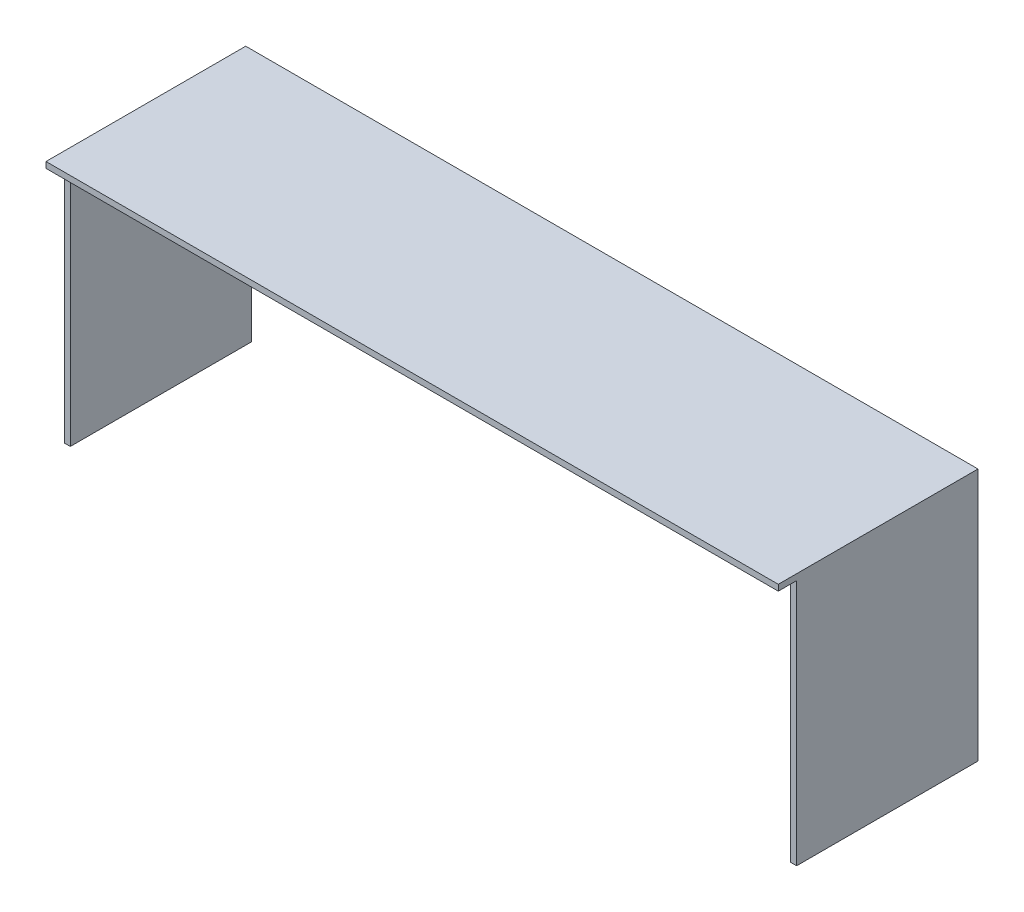
from build123d import *

# Parameters (mm, degrees)
SKETCH1_W           = 2200
SKETCH1_H           = 600
BOSS_EXTRUDE1_DEPTH = 18
SKETCH2_W           = 18
SKETCH2_H           = 545
BOSS_EXTRUDE2_DEPTH = 742
SKETCH3_W           = 18
SKETCH3_H           = 280
BOSS_EXTRUDE3_DEPTH = 2164


with BuildPart() as part:
    # Sketch1 → Boss-Extrude1 (new body)
    with BuildSketch(Plane(origin=(0, 0, 0), x_dir=(1, 0, 0), z_dir=(0, 1, 0))):
        Rectangle(SKETCH1_W, SKETCH1_H)
    extrude(amount=BOSS_EXTRUDE1_DEPTH)

    # Sketch2 → Boss-Extrude2 (add)
    with BuildSketch(Plane.XZ):
        with Locations((-1091, -27.5)):
            Rectangle(SKETCH2_W, SKETCH2_H)
    boss_extrude2 = extrude(amount=BOSS_EXTRUDE2_DEPTH)

    # Mirror1: Boss-Extrude2 across plane
    add(boss_extrude2.mirror(Plane(origin=(0, 0, 0), x_dir=(0, 0, 1), z_dir=(1, 0, 0))))

    # Sketch3 → Boss-Extrude3 (add)
    with BuildSketch(Plane(origin=(-1082, 0, 0), x_dir=(0, 0, -1), z_dir=(1, 0, 0))):
        with Locations((244, -140)):
            Rectangle(SKETCH3_W, SKETCH3_H)
    extrude(amount=BOSS_EXTRUDE3_DEPTH)


solid = part.part
